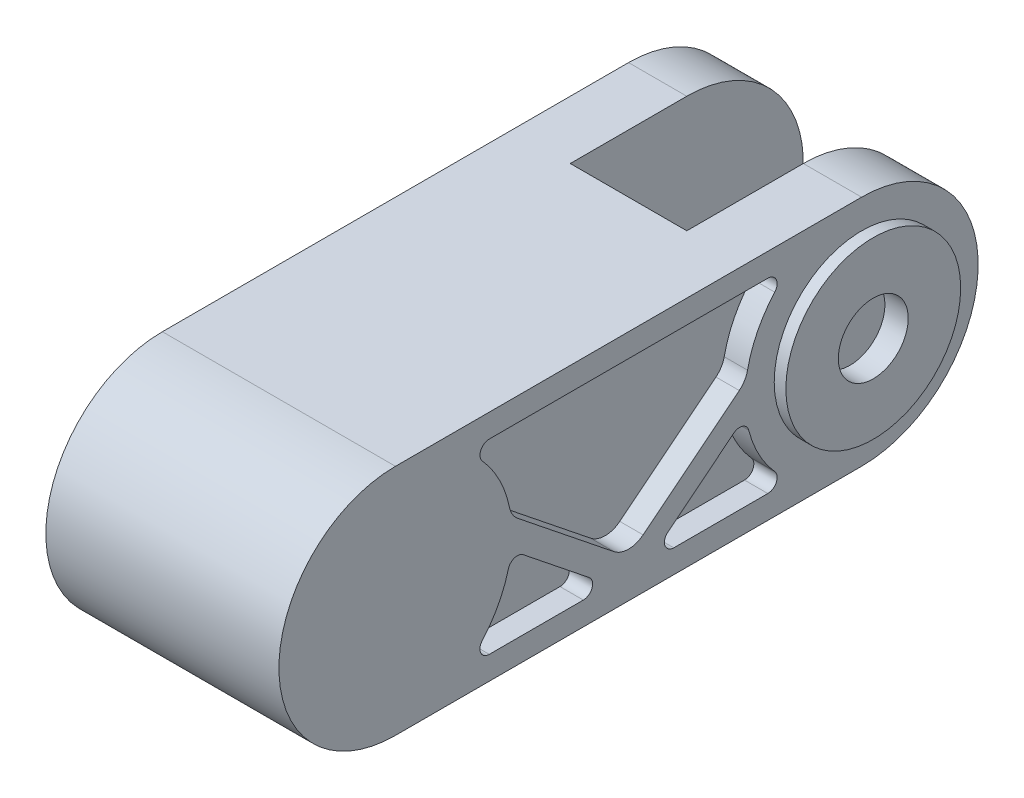
from build123d import *

# Parameters (mm, degrees)
BOSS_EXTRUDE1_DEPTH      = 50
BOSS_EXTRUDE1_DEPTH_BACK = 50
CUT_EXTRUDE1_DEPTH       = 188.082869339
CUT_EXTRUDE1_DEPTH_BACK  = 188.082869339
SKETCH2_W                = 50
SKETCH2_H                = 200
SKETCH3_R                = 37.5
BOSS_EXTRUDE2_DEPTH      = 5
CUT_EXTRUDE2_START       = -10
CUT_EXTRUDE2_DEPTH       = 10
FILLET1_R                = 10
FILLET2_R                = 4
FILLET1_OF_MIRROR2_R     = 10
FILLET2_OF_MIRROR2_R     = 4
SKETCH5_R                = 15
CUT_EXTRUDE3_DEPTH       = 10


with BuildPart() as part:
    # Sketch1 → Boss-Extrude1 (new, two sides: drawn at the far end of the back side and taken through both)
    with BuildSketch(Plane(origin=(0, 0, 0), x_dir=(0, 0, -1), z_dir=(1, 0, 0)).offset(-BOSS_EXTRUDE1_DEPTH_BACK)):
        with BuildLine():
            Line((-100, -50), (100, -50))
            ThreePointArc((100, -50), (150, 0), (100, 50))
            Line((100, 50), (-100, 50))
            ThreePointArc((-100, 50), (-150, 0), (-100, -50))
        make_face()
    extrude(amount=BOSS_EXTRUDE1_DEPTH + BOSS_EXTRUDE1_DEPTH_BACK)

    # Sketch2 → Cut-Extrude1 (cut, two sides: drawn at the far end of the back side and taken through both)
    with BuildSketch(Plane(origin=(0, 50, 0), x_dir=(1, 0, 0), z_dir=(0, 1, 0)).offset(-CUT_EXTRUDE1_DEPTH_BACK)):
        with Locations((0, 150)):
            Rectangle(SKETCH2_W, SKETCH2_H)
    extrude(amount=CUT_EXTRUDE1_DEPTH + CUT_EXTRUDE1_DEPTH_BACK, mode=Mode.SUBTRACT)

    # Sketch3 → Boss-Extrude2 (add)
    with BuildSketch(Plane(origin=(50, 0, 0), x_dir=(0, 0, -1), z_dir=(1, 0, 0))):
        with Locations((100, 0)):
            Circle(SKETCH3_R)
    boss_extrude2 = extrude(amount=BOSS_EXTRUDE2_DEPTH)

    # Mirror1: Boss-Extrude2 across plane
    add(boss_extrude2.mirror(Plane(origin=(0, 0, 0), x_dir=(0, 0, 1), z_dir=(1, 0, 0))))

    # Sketch4 → Cut-Extrude2 (cut)
    with BuildSketch(Plane(origin=(50, 0, 0), x_dir=(0, 0, -1), z_dir=(1, 0, 0)).offset(CUT_EXTRUDE2_START)):
        with BuildLine():
            ThreePointArc((50.46067679, 6.77166567), (56.899460157, 25.344495759), (70, 40))
            Line((70, 40), (-70, 40))
            ThreePointArc((-70, 40), (-56.899460157, 25.344495759), (-50.46067679, 6.77166567))
            Line((-50.46067679, 6.77166567), (0, -33.596875763))
            Line((0, -33.596875763), (50.46067679, 6.77166567))
        make_face()
        with BuildLine():
            ThreePointArc((-50.373979518, -6.103940623), (-56.729785131, -25.053712404), (-70, -40))
            Line((-70, -40), (-8.003905297, -40))
            Line((-8.003905297, -40), (-50.373979518, -6.103940623))
        make_face()
        with BuildLine():
            Line((8.003905297, -40), (70, -40))
            ThreePointArc((70, -40), (56.729785131, -25.053712404), (50.373979518, -6.103940623))
            Line((50.373979518, -6.103940623), (8.003905297, -40))
        make_face()
    cut_extrude2 = extrude(amount=CUT_EXTRUDE2_DEPTH, mode=Mode.SUBTRACT)

    # Fillet1
    fillet1_edges = [part.edges().sort_by_distance(p)[0] for p in [
        (45, 6.77166567, -50.46067679),
        (45, -33.596875763, 0),
        (45, 6.77166567, 50.46067679),
    ]]
    fillet(fillet1_edges, radius=FILLET1_R)

    # Fillet2
    fillet2_edges = [part.edges().sort_by_distance(p)[0] for p in [
        (45, 40, 70),
        (45, 40, -70),
        (45, -40, -70),
        (45, -6.103940623, -50.373979518),
        (45, -6.103940623, 50.373979518),
        (45, -40, -8.003905297),
        (45, -40, 8.003905297),
        (45, -40, 70),
    ]]
    fillet(fillet2_edges, radius=FILLET2_R)

    # Mirror2: Cut-Extrude2 across plane
    add(cut_extrude2.mirror(Plane(origin=(0, 0, 0), x_dir=(0, 0, 1), z_dir=(1, 0, 0))), mode=Mode.SUBTRACT)

    # Fillet1 of Mirror2
    fillet1_of_mirror2_edges = [part.edges().sort_by_distance(p)[0] for p in [
        (-45, 6.77166567, -50.46067679),
        (-45, -33.596875763, 0),
        (-45, 6.77166567, 50.46067679),
    ]]
    fillet(fillet1_of_mirror2_edges, radius=FILLET1_OF_MIRROR2_R)

    # Fillet2 of Mirror2
    fillet2_of_mirror2_edges = [part.edges().sort_by_distance(p)[0] for p in [
        (-45, 40, 70),
        (-45, 40, -70),
        (-45, -40, -70),
        (-45, -6.103940623, -50.373979518),
        (-45, -6.103940623, 50.373979518),
        (-45, -40, -8.003905297),
        (-45, -40, 8.003905297),
        (-45, -40, 70),
    ]]
    fillet(fillet2_of_mirror2_edges, radius=FILLET2_OF_MIRROR2_R)

    # Sketch5 → Cut-Extrude3 (cut)
    with BuildSketch(Plane(origin=(55, 0, 0), x_dir=(0, 0, -1), z_dir=(1, 0, 0))):
        with Locations((100, 0)):
            Circle(SKETCH5_R)
    cut_extrude3 = extrude(amount=-CUT_EXTRUDE3_DEPTH, mode=Mode.SUBTRACT)

    # Mirror3: Cut-Extrude3 across plane
    add(cut_extrude3.mirror(Plane(origin=(0, 0, 0), x_dir=(0, 0, 1), z_dir=(1, 0, 0))), mode=Mode.SUBTRACT)


solid = part.part
